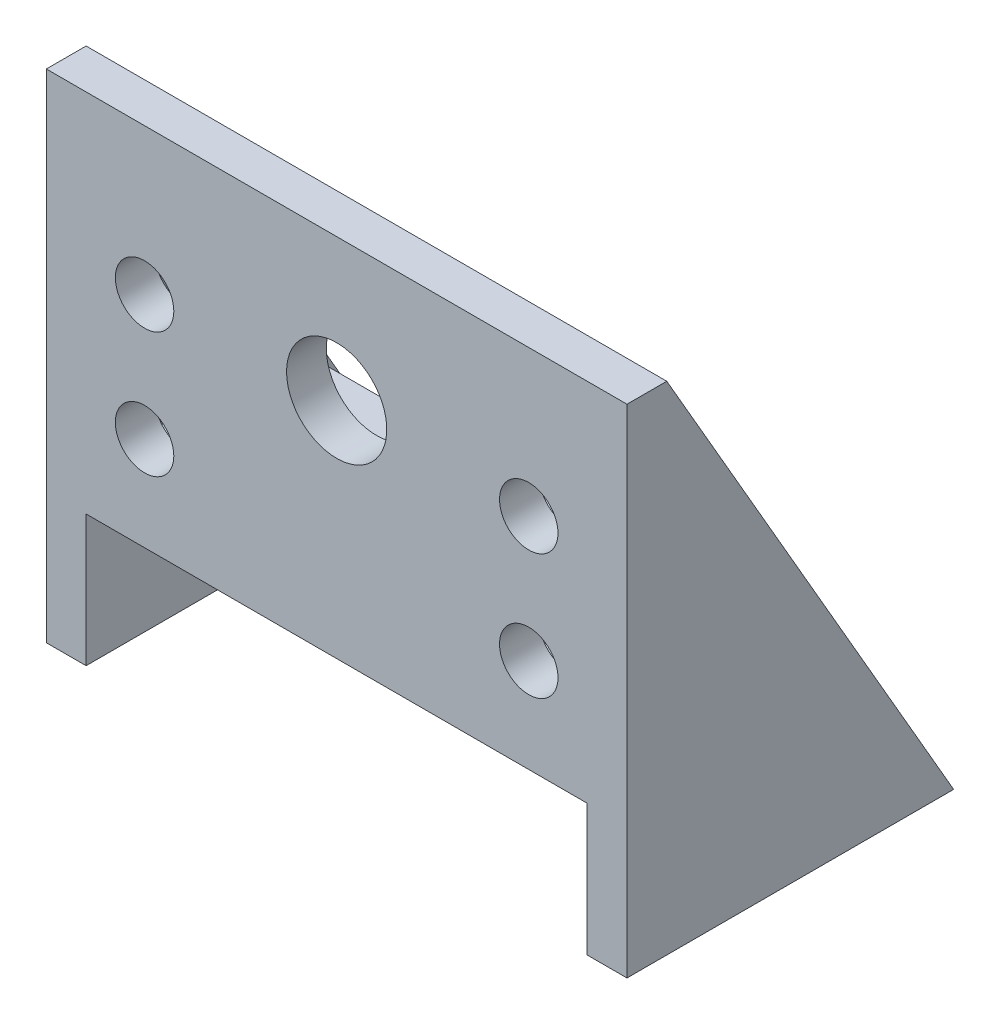
from build123d import *

# Parameters (mm, degrees)
CROQUIS1_W              = 60
CROQUIS1_H              = 39
CROQUIS1_R              = 6
SALIENTE_EXTRUIR1_DEPTH = 4.7625
SALIENTE_EXTRUIR2_DEPTH = 4.7625
SALIENTE_EXTRUIR3_START = -60
SALIENTE_EXTRUIR3_DEPTH = 4.7625
CROQUIS4_W              = 60
CROQUIS4_H              = 4.7625
SALIENTE_EXTRUIR4_DEPTH = 25
CROQUIS5_R              = 3.5
CORTAR_EXTRUIR1_DEPTH   = 10


with BuildPart() as part:
    # Croquis1 → Saliente-Extruir1 (new body)
    with BuildSketch(Plane.XY):
        with Locations((-7.709348333, -11.433962264)):
            Rectangle(CROQUIS1_W, CROQUIS1_H)
        with Locations(Location((-7.709348333, -8.933962264, 0), (0, 0, 180))):
            Circle(CROQUIS1_R, mode=Mode.SUBTRACT)
    extrude(amount=SALIENTE_EXTRUIR1_DEPTH)

    # Croquis2 → Saliente-Extruir2 (add)
    with BuildSketch(Plane(origin=(22.290651667, 0, 0), x_dir=(0, 0, -1), z_dir=(1, 0, 0))):
        Polygon((-4.7625, 8.066037736), (-4.7625, -51.433962264), (34.352341017, -51.433962264), (0, 8.066037736), align=None)
    extrude(amount=SALIENTE_EXTRUIR2_DEPTH)

    # Croquis2<2> → Saliente-Extruir3 (add)
    with BuildSketch(Plane(origin=(22.290651667, 0, 0), x_dir=(0, 0, -1), z_dir=(1, 0, 0)).offset(SALIENTE_EXTRUIR3_START)):
        Polygon((-4.7625, 8.066037736), (-4.7625, -51.433962264), (34.352341017, -51.433962264), (0, 8.066037736), align=None)
    extrude(amount=-SALIENTE_EXTRUIR3_DEPTH)

    # Croquis4 → Saliente-Extruir4 (add)
    with BuildSketch(Plane.XY.offset(4.7625)):
        with Locations((-7.709348333, -33.315212264)):
            Rectangle(CROQUIS4_W, CROQUIS4_H)
    extrude(amount=-SALIENTE_EXTRUIR4_DEPTH)

    # Croquis5 → Cortar-Extruir1 (cut)
    with BuildSketch(Plane.XY.offset(4.7625)):
        with Locations((-30.709348333, -9.433962264)):
            Circle(CROQUIS5_R)
        with Locations((15.290651667, -9.433962264)):
            Circle(CROQUIS5_R)
        with Locations((15.290651667, -24.433962264)):
            Circle(CROQUIS5_R)
        with Locations((-30.709348333, -24.433962264)):
            Circle(CROQUIS5_R)
    extrude(amount=-CORTAR_EXTRUIR1_DEPTH, mode=Mode.SUBTRACT)


solid = part.part
